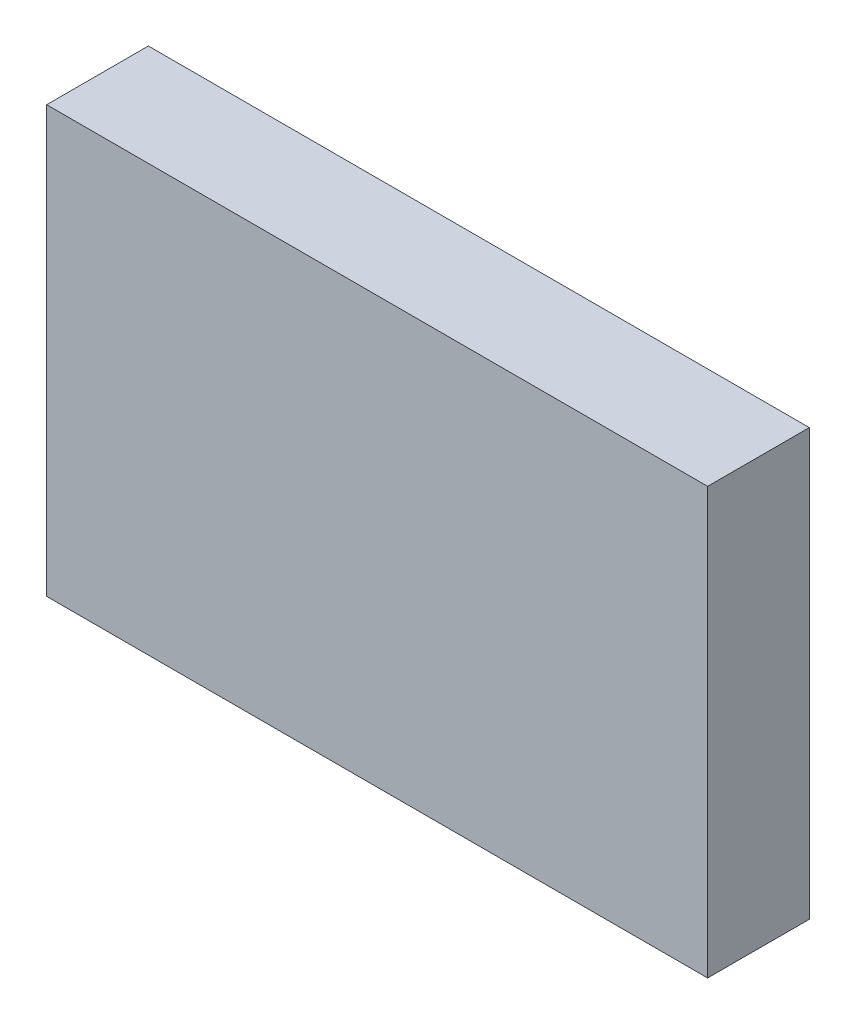
from build123d import *

# Parameters (mm, degrees)
SKETCH_1_W      = 52
SKETCH_1_H      = 33.5
EXTRUDE_1_DEPTH = 8


with BuildPart() as part:
    # 草图1 → 凸台-拉伸1 (new body)
    with BuildSketch(Plane.XY):
        with Locations((26, -16.75)):
            Rectangle(SKETCH_1_W, SKETCH_1_H)
    extrude(amount=EXTRUDE_1_DEPTH)


solid = part.part
